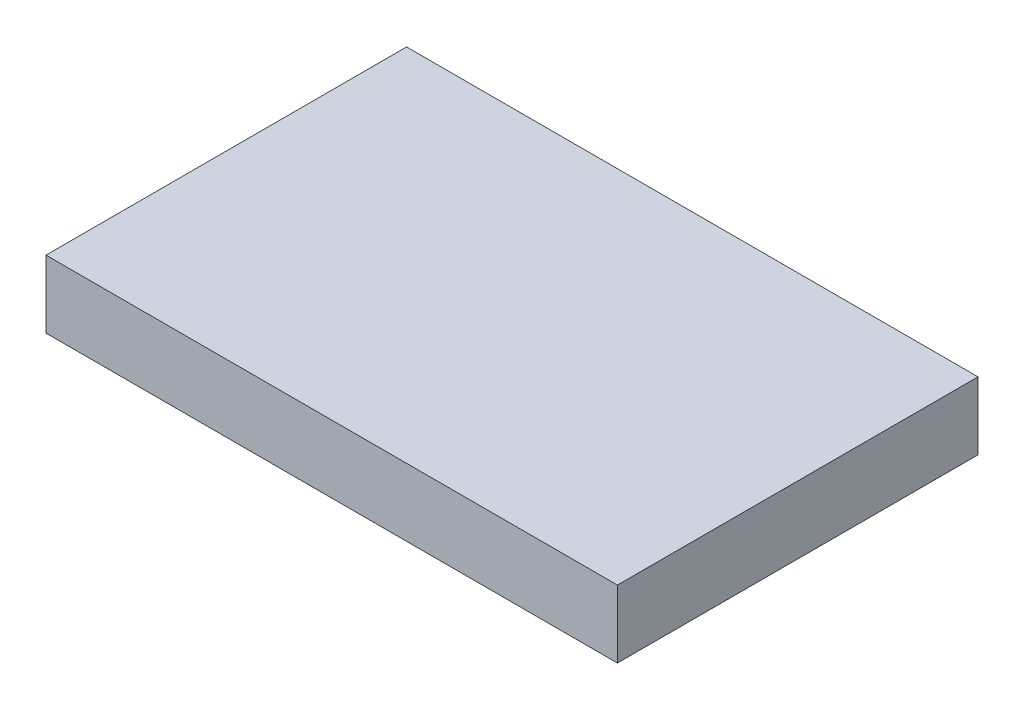
from build123d import *

# Parameters (mm, degrees)
SKETCH2_W      = 107.413416435
SKETCH2_H      = 67.779871235
EXTRUDE2_DEPTH = 12.7


with BuildPart() as part:
    # Sketch2 → Extrude2 (new body)
    with BuildSketch(Plane(origin=(0, 0, 0), x_dir=(1, 0, 0), z_dir=(0, 1, 0))):
        with Locations((53.706708218, 33.889935618)):
            Rectangle(SKETCH2_W, SKETCH2_H)
    extrude(amount=-EXTRUDE2_DEPTH)


solid = part.part
